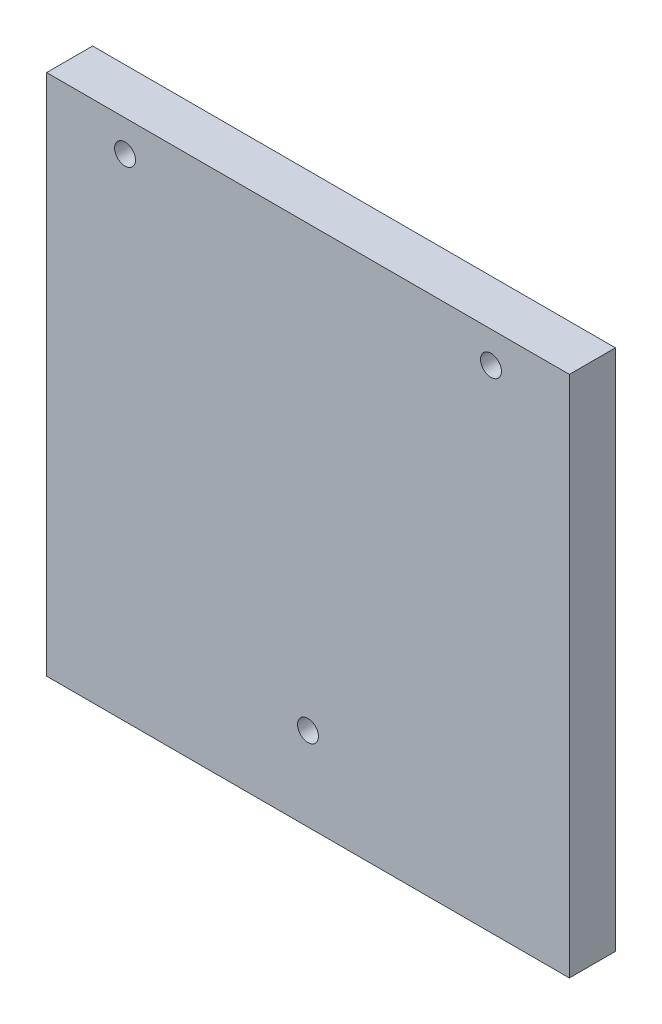
from build123d import *

# Parameters (mm, degrees)
ESQUISSE1_W          = 250
ESQUISSE1_H          = 250
BOSS_EXTRU_1_DEPTH   = 22
D_GAGEMENT_M81_D     = 10
D_GAGEMENT_M81_DEPTH = 208
D_GAGEMENT_M81_TIP   = 3.004303095


with BuildPart() as part:
    # Esquisse1 → Boss.-Extru.1 (new body)
    with BuildSketch(Plane.XY):
        Rectangle(ESQUISSE1_W, ESQUISSE1_H)
    extrude(amount=BOSS_EXTRU_1_DEPTH)

    # Dégagement M81
    with Locations(Plane(origin=(0, 110, -30), x_dir=(-1, 0, 0), z_dir=(0, 0, -1))):
        with Locations((-87.5, 0), (87.5, 0), (0, -195)):
            Hole(D_GAGEMENT_M81_D / 2, depth=D_GAGEMENT_M81_DEPTH)
            with Locations((0, 0, -(D_GAGEMENT_M81_DEPTH + D_GAGEMENT_M81_TIP / 2))):  # 118° drill point
                Cone(0, D_GAGEMENT_M81_D / 2, D_GAGEMENT_M81_TIP, mode=Mode.SUBTRACT)


solid = part.part
